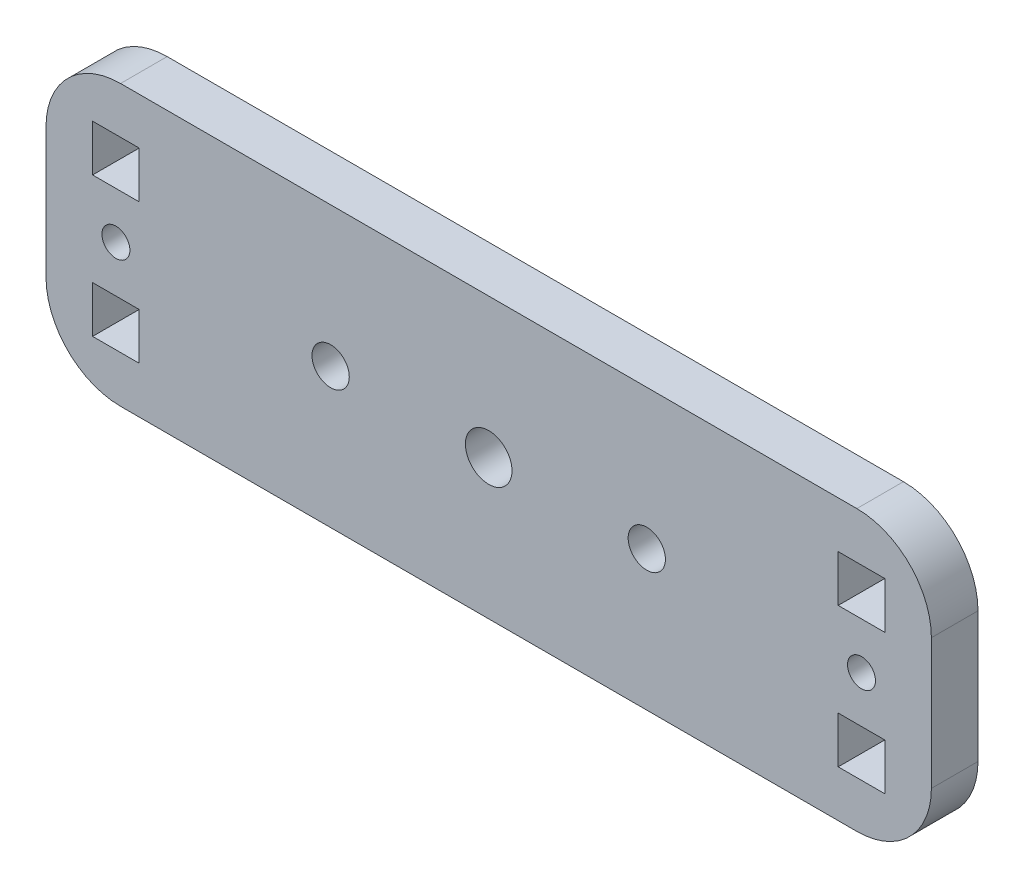
from build123d import *

# Parameters (mm, degrees)
ESQUISSE1_R        = 1.5
ESQUISSE1_R_2      = 2
ESQUISSE1_R_3      = 2.5
ESQUISSE1_W        = 5
ESQUISSE1_H        = 5
BOSS_EXTRU_1_DEPTH = 5


with BuildPart() as part:
    # Esquisse1 → Boss.-Extru.1 (new body)
    with BuildSketch(Plane.XY):
        with BuildLine():
            Line((8, 0), (87, 0))
            ThreePointArc((87, 0), (92.656854249, 2.343145751), (95, 8))
            Line((95, 8), (95, 22))
            ThreePointArc((95, 22), (92.656854249, 27.656854249), (87, 30))
            Line((87, 30), (8, 30))
            ThreePointArc((8, 30), (2.343145751, 27.656854249), (0, 22))
            Line((0, 22), (0, 8))
            ThreePointArc((0, 8), (2.343145751, 2.343145751), (8, 0))
        make_face()
        with Locations((7.5, 15)):
            Circle(ESQUISSE1_R, mode=Mode.SUBTRACT)
        with Locations((87.5, 15)):
            Circle(ESQUISSE1_R, mode=Mode.SUBTRACT)
        with Locations((30.54, 15)):
            Circle(ESQUISSE1_R_2, mode=Mode.SUBTRACT)
        with Locations((64.46, 15)):
            Circle(ESQUISSE1_R_2, mode=Mode.SUBTRACT)
        with Locations((47.5, 15)):
            Circle(ESQUISSE1_R_3, mode=Mode.SUBTRACT)
        with Locations((7.5, 22.5)):
            Rectangle(ESQUISSE1_W, ESQUISSE1_H, mode=Mode.SUBTRACT)
        with Locations((87.5, 22.5)):
            Rectangle(ESQUISSE1_W, ESQUISSE1_H, mode=Mode.SUBTRACT)
        with Locations((87.5, 7.5)):
            Rectangle(ESQUISSE1_W, ESQUISSE1_H, mode=Mode.SUBTRACT)
        with Locations((7.5, 7.5)):
            Rectangle(ESQUISSE1_W, ESQUISSE1_H, mode=Mode.SUBTRACT)
    extrude(amount=BOSS_EXTRU_1_DEPTH)


solid = part.part
